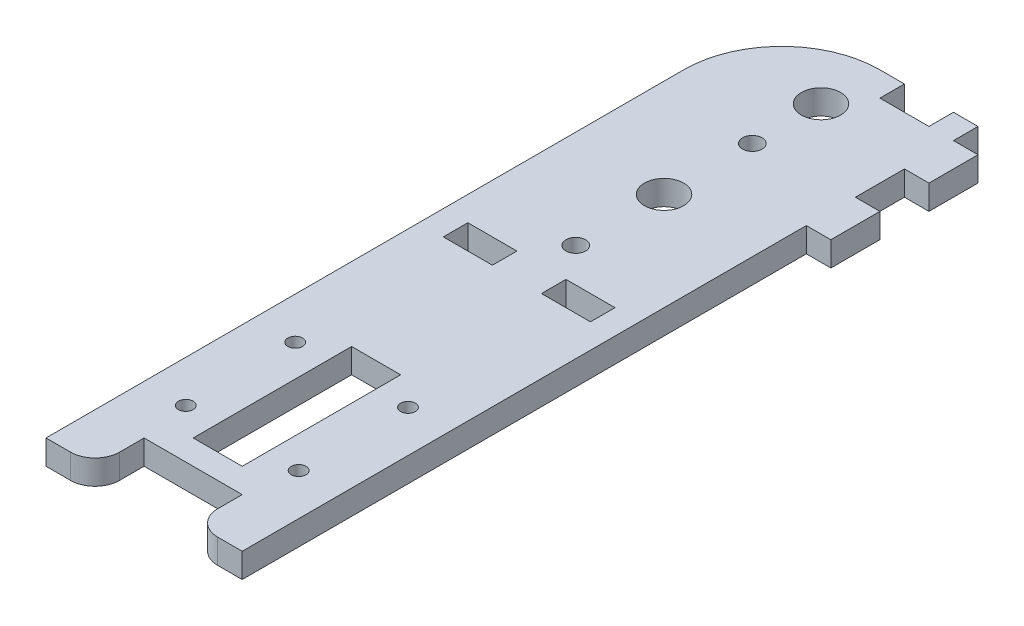
from build123d import *

# Parameters (mm, degrees)
SKETCH_1_R      = 4
SKETCH_1_R_2    = 2
SKETCH_1_R_3    = 1.5
SKETCH_1_W      = 10
SKETCH_1_H      = 5
SKETCH_1_H_2    = 32.3
EXTRUDE_1_DEPTH = 5


with BuildPart() as part:
    # 草图1 → 凸台-拉伸1 (new body)
    with BuildSketch(Plane(origin=(0, 0, 0), x_dir=(1, 0, 0), z_dir=(0, 1, 0))):
        with BuildLine():
            Line((10, 5), (10, 10))
            Line((10, 10), (30, 10))
            Line((30, 10), (30, 5))
            ThreePointArc((30, 5), (31.464466094, 1.464466094), (35, 0))
            Line((35, 0), (40, 0))
            Line((40, 0), (40, 115))
            Line((40, 115), (45, 115))
            Line((45, 115), (45, 125))
            Line((45, 125), (40, 125))
            Line((40, 125), (40, 135))
            Line((40, 135), (45, 135))
            Line((45, 135), (45, 145))
            Line((45, 145), (40, 145))
            Line((40, 145), (40, 150))
            Line((40, 150), (35, 150))
            Line((35, 150), (35, 145))
            Line((35, 145), (25, 145))
            Line((25, 145), (25, 150))
            Line((25, 150), (20, 150))
            ThreePointArc((20, 150), (5.857864376, 144.142135624), (0, 130))
            Line((0, 130), (0, 0))
            Line((0, 0), (5, 0))
            ThreePointArc((5, 0), (8.535533906, 1.464466094), (10, 5))
        make_face()
        with Locations(Location((20, 138, 0), (0, 0, 270))):
            Circle(SKETCH_1_R, mode=Mode.SUBTRACT)
        with Locations(Location((20, 106, 0), (0, 0, 270))):
            Circle(SKETCH_1_R, mode=Mode.SUBTRACT)
        with Locations(Location((20, 124, 0), (0, 0, 270))):
            Circle(SKETCH_1_R_2, mode=Mode.SUBTRACT)
        with Locations(Location((20, 88, 0), (0, 0, 270))):
            Circle(SKETCH_1_R_2, mode=Mode.SUBTRACT)
        with Locations(Location((8.5, 42.3, 0), (0, 0, 270))):
            Circle(SKETCH_1_R_3, mode=Mode.SUBTRACT)
        with Locations(Location((31.5, 42.3, 0), (0, 0, 270))):
            Circle(SKETCH_1_R_3, mode=Mode.SUBTRACT)
        with Locations(Location((8.5, 20, 0), (0, 0, 270))):
            Circle(SKETCH_1_R_3, mode=Mode.SUBTRACT)
        with Locations(Location((31.5, 20, 0), (0, 0, 270))):
            Circle(SKETCH_1_R_3, mode=Mode.SUBTRACT)
        with Locations((10, 78.5)):
            Rectangle(SKETCH_1_W, SKETCH_1_H, mode=Mode.SUBTRACT)
        with Locations((30, 78.5)):
            Rectangle(SKETCH_1_W, SKETCH_1_H, mode=Mode.SUBTRACT)
        with Locations((20, 31.15)):
            Rectangle(SKETCH_1_W, SKETCH_1_H_2, mode=Mode.SUBTRACT)
    extrude(amount=EXTRUDE_1_DEPTH)


solid = part.part
